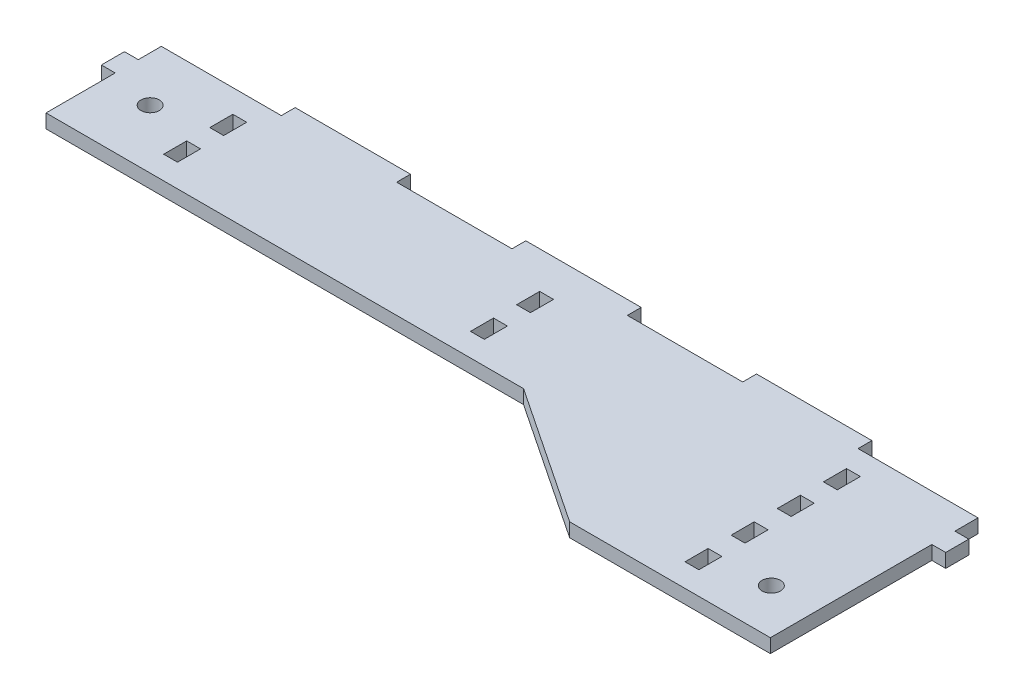
from build123d import *

# Parameters (mm, degrees)
P_IDAT_VYSUNUT_M1_DEPTH  = 3
SKICA2_W                 = 3
SKICA2_H                 = 5
ODEBRAT_VYSUNUT_M1_DEPTH = 100.328998787
SKICA3_W                 = 25
SKICA3_H                 = 3
SKICA3_W_2               = 3
SKICA3_H_2               = 5
P_IDAT_VYSUNUT_M2_DEPTH  = 3
SKICA4_R                 = 2
ODEBRAT_VYSUNUT_M3_DEPTH = 103.011028816


with BuildPart() as part:
    # Skica1 → Přidat vysunutím1 (new body)
    with BuildSketch(Plane(origin=(0, 0, 0), x_dir=(1, 0, 0), z_dir=(0, 1, 0))):
        Polygon((-88.5, 0), (88.5, 0), (88.5, -45), (45, -45), (15, -25), (-88.5, -25), align=None)
    extrude(amount=P_IDAT_VYSUNUT_M1_DEPTH)

    # Skica2 → Odebrat vysunutím1 (cut, through all)
    with BuildSketch(Plane(origin=(0, 0, 0), x_dir=(1, 0, 0), z_dir=(0, 1, 0))):
        with Locations((0, -7.5)):
            Rectangle(SKICA2_W, SKICA2_H)
        with Locations((0, -17.5)):
            Rectangle(SKICA2_W, SKICA2_H)
        with Locations((-66.5, -7.5)):
            Rectangle(SKICA2_W, SKICA2_H)
        with Locations((-66.5, -17.5)):
            Rectangle(SKICA2_W, SKICA2_H)
        with Locations((66.5, -7.5)):
            Rectangle(SKICA2_W, SKICA2_H)
        with Locations((66.5, -17.5)):
            Rectangle(SKICA2_W, SKICA2_H)
        with Locations((66.5, -27.5)):
            Rectangle(SKICA2_W, SKICA2_H)
        with Locations((66.5, -37.5)):
            Rectangle(SKICA2_W, SKICA2_H)
    extrude(amount=ODEBRAT_VYSUNUT_M1_DEPTH, mode=Mode.SUBTRACT)

    # Skica3 → Přidat vysunutím2 (add)
    with BuildSketch(Plane(origin=(0, 0, 0), x_dir=(1, 0, 0), z_dir=(0, 1, 0))):
        with Locations((-50, 1.5)):
            Rectangle(SKICA3_W, SKICA3_H)
        with Locations((0, 1.5)):
            Rectangle(SKICA3_W, SKICA3_H)
        with Locations((50, 1.5)):
            Rectangle(SKICA3_W, SKICA3_H)
        with Locations((90, -7.5)):
            Rectangle(SKICA3_W_2, SKICA3_H_2)
        with Locations((-90, -7.5)):
            Rectangle(SKICA3_W_2, SKICA3_H_2)
    extrude(amount=P_IDAT_VYSUNUT_M2_DEPTH)

    # Skica4 → Odebrat vysunutím3 (cut, through all)
    with BuildSketch(Plane(origin=(0, 0, 0), x_dir=(1, 0, 0), z_dir=(0, 1, 0))):
        with Locations(Location((-78.65, -12.27, 0), (0, 0, 90))):
            Circle(SKICA4_R)
        with Locations(Location((78.83, -35.13, 0), (0, 0, 90))):
            Circle(SKICA4_R)
    extrude(amount=ODEBRAT_VYSUNUT_M3_DEPTH, mode=Mode.SUBTRACT)


solid = part.part
